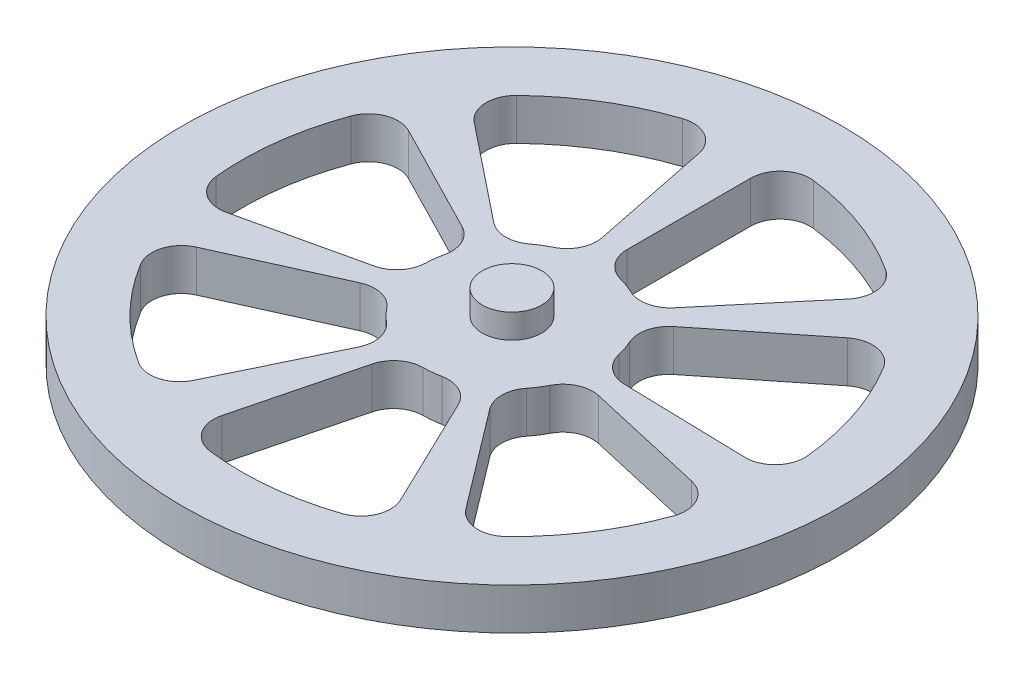
from build123d import *

# Parameters (mm, degrees)
SKETCH1_R                = 55.5
BOSS_EXTRUDE1_DEPTH      = 7
CUT_EXTRUDE1_DEPTH       = 7
FILLET1_R                = 5
CIRPATTERN1_COUNT        = 7
FILLET1_OF_CIRPATTERN1_R = 5
SKETCH3_R                = 5
BOSS_EXTRUDE2_DEPTH      = 4.1


with BuildPart() as part:
    # Sketch1 → Boss-Extrude1 (new body)
    with BuildSketch(Plane(origin=(0, 0, 0), x_dir=(1, 0, 0), z_dir=(0, 1, 0))):
        with Locations(Location((0, 0, 0), (0, 0, 270))):
            Circle(SKETCH1_R)
    extrude(amount=BOSS_EXTRUDE1_DEPTH)

    # Sketch2 → Cut-Extrude1 (cut)
    with BuildSketch(Plane(origin=(0, 7, 0), x_dir=(1, 0, 0), z_dir=(0, 1, 0))):
        with BuildLine():
            Line((0, 15), (0, 45.5))
            ThreePointArc((0, 45.5), (15.561916521, 42.756014246), (29.246836241, 34.855022162))
            Line((29.246836241, 34.855022162), (9.641814145, 11.490666647))
            ThreePointArc((9.641814145, 11.490666647), (5.13030215, 14.095389312), (0, 15))
        make_face()
    cut_extrude1 = extrude(amount=-CUT_EXTRUDE1_DEPTH, mode=Mode.SUBTRACT)

    # Fillet1
    fillet1_edges = [part.edges().sort_by_distance(p)[0] for p in [
        (9.641814145, 3.5, -11.490666647),
        (0, 3.5, -15),
        (0, 3.5, -45.5),
        (29.246836241, 3.5, -34.855022162),
    ]]
    fillet(fillet1_edges, radius=FILLET1_R)

    # CirPattern1: Cut-Extrude1 ×7 about axis
    cirpattern1_axis = Axis((0, 0, 0), (0, 1, 0))
    for i in range(1, CIRPATTERN1_COUNT):
        add(cut_extrude1.rotate(cirpattern1_axis, i * 360 / CIRPATTERN1_COUNT), mode=Mode.SUBTRACT)

    # Fillet1 of CirPattern1
    fillet1_of_cirpattern1_edges = [part.edges().sort_by_distance(p)[0] for p in [
        (-2.972192148, 3.5, -14.702587318),
        (-11.727472237, 3.5, -9.352347028),
        (-35.573332452, 3.5, -28.368785985),
        (-9.015649516, 3.5, -44.597848197),
        (-13.348077132, 3.5, -6.84315986),
        (-14.623918683, 3.5, 3.337814009),
        (-44.359220004, 3.5, 10.124702495),
        (-40.489167301, 3.5, -20.75758491),
        (-13.672587785, 3.5, 6.169306547),
        (-6.508256087, 3.5, 13.514533019),
        (-19.74171013, 3.5, 40.99408349),
        (-41.47351628, 3.5, 18.713563192),
        (-3.701360965, 3.5, 14.536159293),
        (6.508256087, 3.5, 13.514533019),
        (19.74171013, 3.5, 40.99408349),
        (-11.227461595, 3.5, 44.093016523),
        (9.057066155, 3.5, 11.956987608),
        (14.623918683, 3.5, 3.337814009),
        (44.359220004, 3.5, 10.124702495),
        (27.47310067, 3.5, 36.269529079),
        (14.99533773, 3.5, 0.373960376),
        (11.727472237, 3.5, -9.352347028),
        (35.573332452, 3.5, -28.368785985),
        (45.485857781, 3.5, 1.134346474),
    ]]
    fillet(fillet1_of_cirpattern1_edges, radius=FILLET1_OF_CIRPATTERN1_R)

    # Sketch3 → Boss-Extrude2 (add)
    with BuildSketch(Plane(origin=(0, 7, 0), x_dir=(1, 0, 0), z_dir=(0, 1, 0))):
        with Locations(Location((0, 0, 0), (0, 0, 270))):
            Circle(SKETCH3_R)
    extrude(amount=BOSS_EXTRUDE2_DEPTH)


solid = part.part
